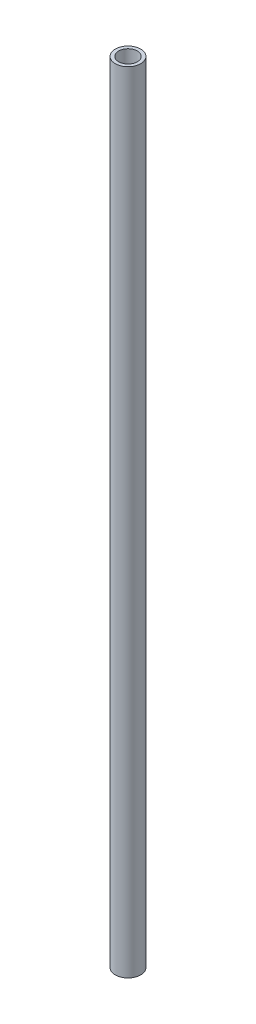
from build123d import *

# Parameters (mm, degrees)
SKETCH1_R           = 4.7498
SKETCH1_R_2         = 3.5052
BOSS_EXTRUDE1_DEPTH = 295.275


with BuildPart() as part:
    # Sketch1 → Boss-Extrude1 (new body)
    with BuildSketch(Plane(origin=(0, 0, 0), x_dir=(1, 0, 0), z_dir=(0, 1, 0))):
        with Locations(Location((0, 0, 0), (0, 0, 270))):
            Circle(SKETCH1_R)
        with Locations(Location((0, 0, 0), (0, 0, 270))):
            Circle(SKETCH1_R_2, mode=Mode.SUBTRACT)
    extrude(amount=BOSS_EXTRUDE1_DEPTH)


solid = part.part
